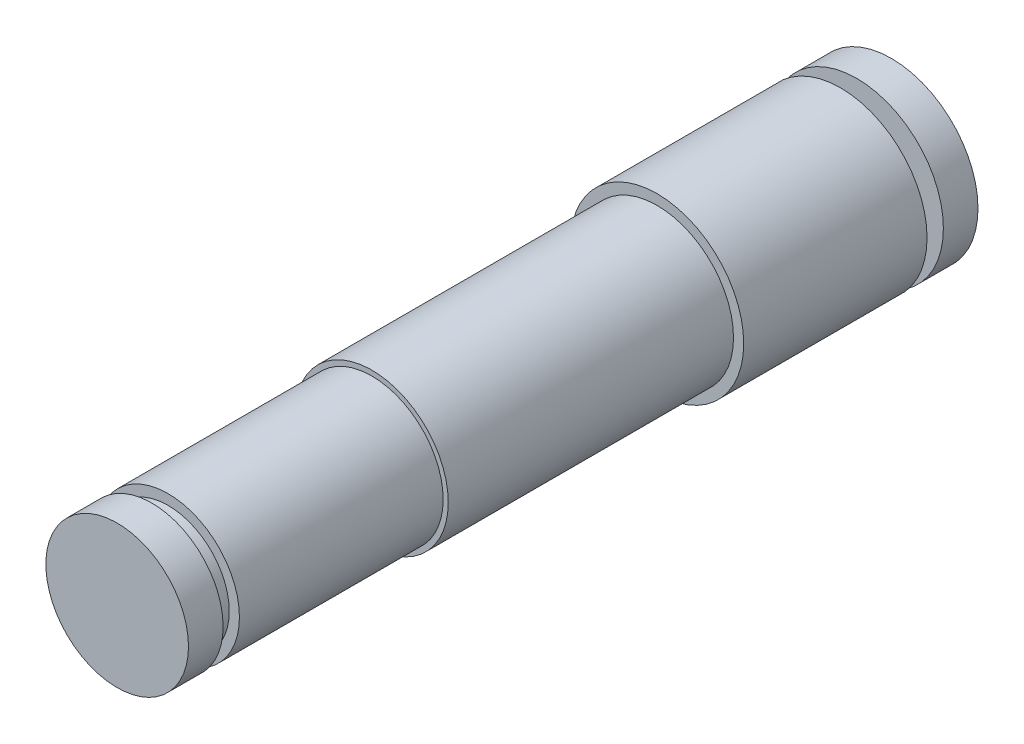
from build123d import *


with BuildPart() as part:
    # 草图1 → 旋转1 (revolve)
    with BuildSketch(Plane(origin=(0, 0, 0), x_dir=(1, 0, 0), z_dir=(0, 1, 0))):
        Polygon((0, 0), (35, 0), (35, 17), (30, 17), (30, 25), (35, 25), (35, 125), (37.5, 125), (37.5, 265), (42.5, 265), (42.5, 355), (30.5, 355), (30.5, 363), (42.5, 363), (42.5, 380), (0, 380), align=None)
    revolve(axis=Axis((0, 0, 1000), (0, 0, -1)))


solid = part.part
